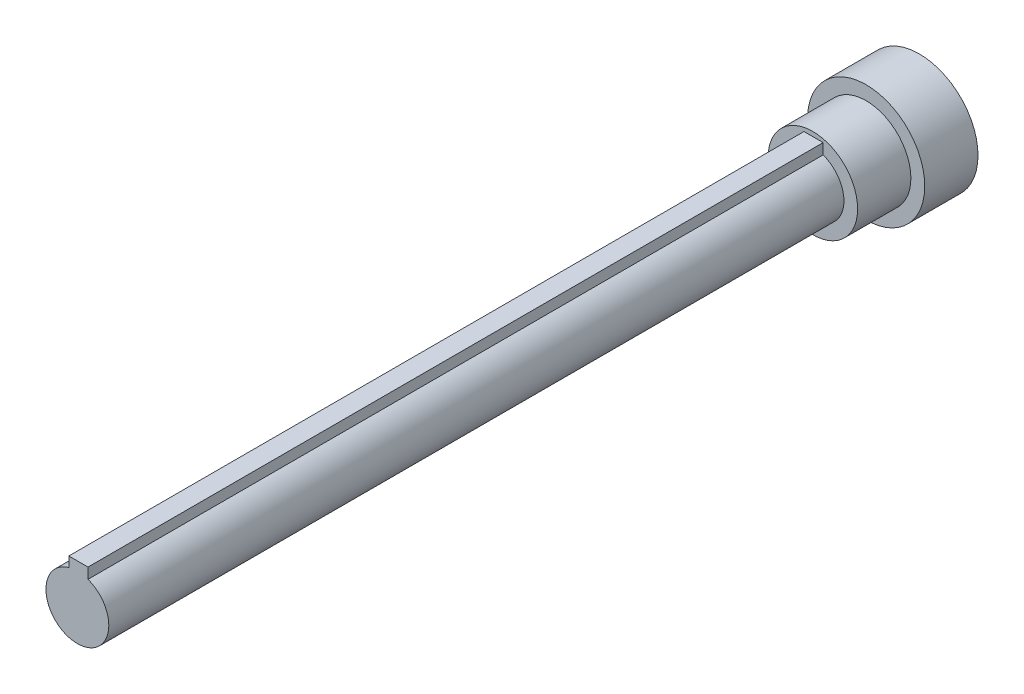
from build123d import *

# Parameters (mm, degrees)
SKETCH1_R           = 5.5
BOSS_EXTRUDE1_DEPTH = 5
SKETCH3_R           = 4.2
BOSS_EXTRUDE3_DEPTH = 5
BOSS_EXTRUDE2_DEPTH = 69


with BuildPart() as part:
    # Sketch1 → Boss-Extrude1 (new body)
    with BuildSketch(Plane(origin=(0, 0, 0), x_dir=(0, 1, 0), z_dir=(0, 0, 1))):
        with Locations(Location((0, 0, 0), (0, 0, 270))):
            Circle(SKETCH1_R)
    extrude(amount=BOSS_EXTRUDE1_DEPTH)

    # Sketch3 → Boss-Extrude3 (add)
    with BuildSketch(Plane.XY.offset(5)):
        Circle(SKETCH3_R)
    extrude(amount=BOSS_EXTRUDE3_DEPTH)

    # Sketch2 → Boss-Extrude2 (add)
    with BuildSketch(Plane.XY.offset(10)):
        with BuildLine():
            Line((-0.834166667, 3.775921626), (0.965833333, 3.775921626))
            Line((0.965833333, 3.775921626), (0.965833333, 2.775921626))
            ThreePointArc((0.965833333, 2.775921626), (-0.13585463, -2.948190479), (-0.834166667, 2.838996753))
            Line((-0.834166667, 2.838996753), (-0.834166667, 3.775921626))
        make_face()
    extrude(amount=BOSS_EXTRUDE2_DEPTH)


solid = part.part
